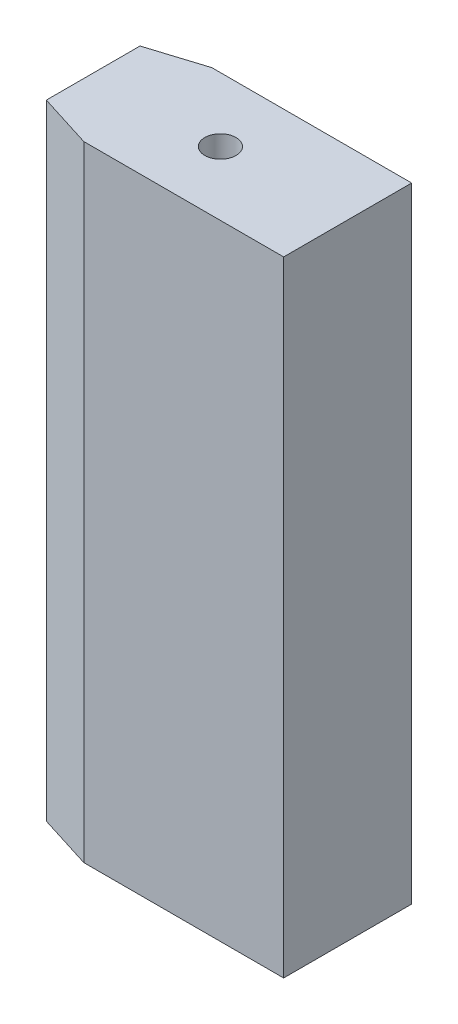
from build123d import *

# Parameters (mm, degrees)
BOSS_EXTRUDE1_DEPTH = 40
CUT_EXTRUDE1_DEPTH  = 44.965099795


with BuildPart() as part:
    # Sketch1 → Boss-Extrude1 (new body)
    with BuildSketch(Plane(origin=(0, 0, 0), x_dir=(1, 0, 0), z_dir=(0, 1, 0))):
        Polygon((-16.3, 4.1), (0, 4.1), (0, 8.2), (-12.8, 8.2), (-16.3, 7.1), align=None)
        Polygon((-12.8, 0), (0, 0), (0, 4.1), (-16.3, 4.1), (-16.3, 1.1), align=None)
    extrude(amount=BOSS_EXTRUDE1_DEPTH)

    # Sketch2 → Cut-Extrude1 (cut, through all)
    with BuildSketch(Plane(origin=(0, 40, 0), x_dir=(1, 0, 0), z_dir=(0, 1, 0))):
        with BuildLine():
            ThreePointArc((-9.15, 4.1), (-8.15, 3.1), (-7.15, 4.1))
            Line((-7.15, 4.1), (-9.15, 4.1))
        make_face()
        with BuildLine():
            Line((-9.15, 4.1), (-7.15, 4.1))
            ThreePointArc((-7.15, 4.1), (-8.15, 5.1), (-9.15, 4.1))
        make_face()
    extrude(amount=-CUT_EXTRUDE1_DEPTH, mode=Mode.SUBTRACT)


solid = part.part
